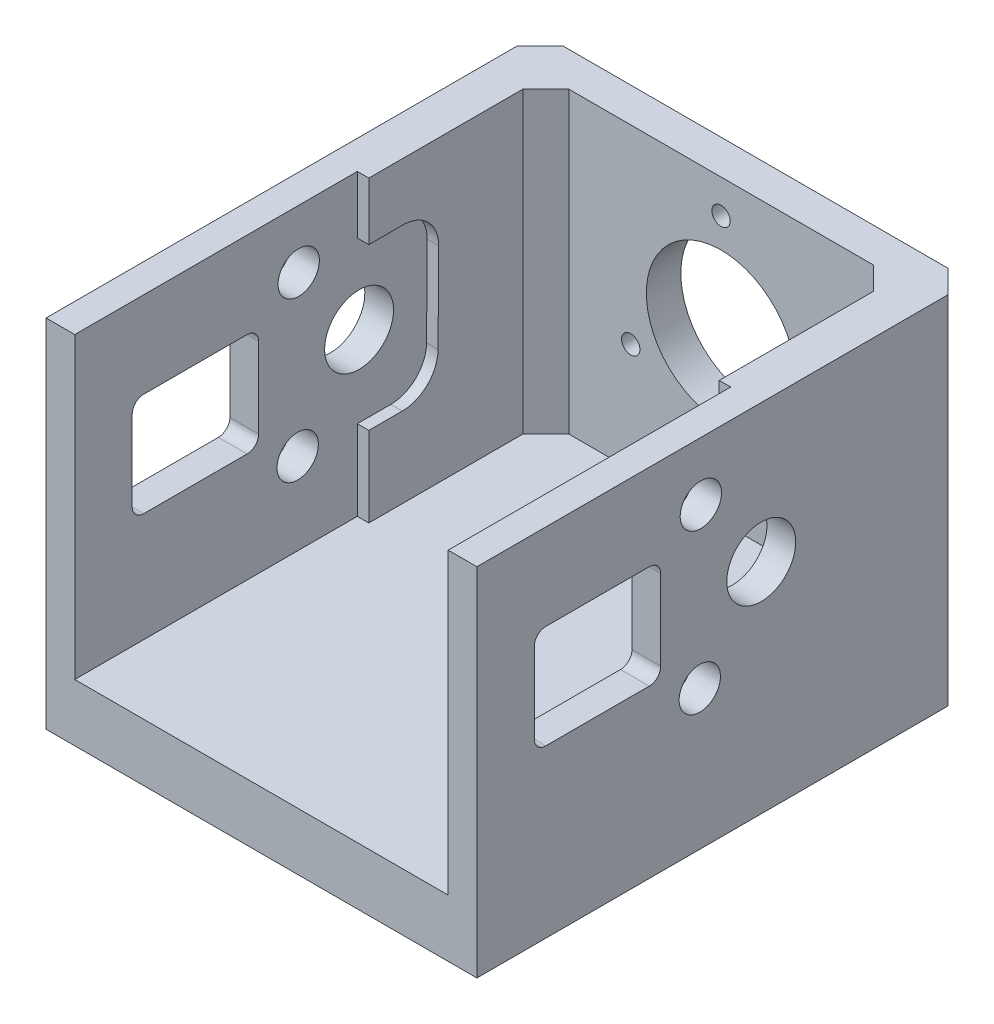
from build123d import *

# Parameters (mm, degrees)
SKETCH1_W            = 37.5
SKETCH1_H            = 24
SKETCH1_R            = 0.8
SKETCH1_R_2          = 6.5
BOSS_EXTRUDE1_DEPTH  = 3
SKETCH2_W            = 2.5
SKETCH2_H            = 40
BOSS_EXTRUDE2_DEPTH  = 24
BOSS_EXTRUDE3_DEPTH  = 1
BOSS_EXTRUDE4_START  = 31.5
BOSS_EXTRUDE4_DEPTH  = 1
M3_CLEARANCE_HOLE1_D = 3.6
CHAMFER1_SIZE        = 2
SKETCH7_R            = 3
SKETCH7_W            = 11
SKETCH7_H            = 9
CUT_EXTRUDE1_DEPTH   = 57.127087934
FILLET1_R            = 1
BOSS_EXTRUDE5_DEPTH  = 2
BOSS_EXTRUDE6_DEPTH  = 5


with BuildPart() as part:
    # Sketch1 → Boss-Extrude1 (new body)
    with BuildSketch(Plane.XY):
        Rectangle(SKETCH1_W, SKETCH1_H)
        with Locations((0, 9.075)):
            Circle(SKETCH1_R, mode=Mode.SUBTRACT)
        with Locations((7.859180539, -4.5375)):
            Circle(SKETCH1_R, mode=Mode.SUBTRACT)
        with Locations((-7.859180539, -4.5375)):
            Circle(SKETCH1_R, mode=Mode.SUBTRACT)
        Circle(SKETCH1_R_2, mode=Mode.SUBTRACT)
    extrude(amount=-BOSS_EXTRUDE1_DEPTH)

    # Sketch2 → Boss-Extrude2 (add)
    with BuildSketch(Plane(origin=(0, 12, 0), x_dir=(1, 0, 0), z_dir=(0, 1, 0))):
        with Locations((-17.5, -20)):
            Rectangle(SKETCH2_W, SKETCH2_H)
        with Locations((17.5, -20)):
            Rectangle(SKETCH2_W, SKETCH2_H)
    extrude(amount=-BOSS_EXTRUDE2_DEPTH)

    # Sketch4 → Boss-Extrude3 (add)
    with BuildSketch(Plane(origin=(-16.25, 0, 0), x_dir=(0, 0, -1), z_dir=(1, 0, 0))):
        with BuildLine():
            Line((-9.328443352, 3.861127794), (-9.37974654, -3.938739946))
            ThreePointArc((-9.37974654, -3.938739946), (-10.302425145, -6.124404492), (-12.500032536, -7.018265261))
            Line((-12.500032536, -7.018265261), (-15.407950321, -7.018265261))
            Line((-15.407950321, -7.018265261), (-15.407950321, -12))
            Line((-15.407950321, -12), (0, -12))
            Line((0, -12), (0, 12))
            Line((0, 12), (-15.407950321, 12))
            Line((-15.407950321, 12), (-15.407950321, 6.981431896))
            Line((-15.407950321, 6.981431896), (-12.407950321, 6.981431896))
            ThreePointArc((-12.407950321, 6.981431896), (-10.222291202, 6.058740436), (-9.328443352, 3.861127794))
        make_face()
    extrude(amount=BOSS_EXTRUDE3_DEPTH)

    # Sketch4<2> → Boss-Extrude4 (add)
    with BuildSketch(Plane(origin=(-16.25, 0, 0), x_dir=(0, 0, -1), z_dir=(1, 0, 0)).offset(BOSS_EXTRUDE4_START)):
        with BuildLine():
            Line((-9.328443352, 3.861127794), (-9.37974654, -3.938739946))
            ThreePointArc((-9.37974654, -3.938739946), (-10.302425145, -6.124404492), (-12.500032536, -7.018265261))
            Line((-12.500032536, -7.018265261), (-15.407950321, -7.018265261))
            Line((-15.407950321, -7.018265261), (-15.407950321, -12))
            Line((-15.407950321, -12), (0, -12))
            Line((0, -12), (0, 12))
            Line((0, 12), (-15.407950321, 12))
            Line((-15.407950321, 12), (-15.407950321, 6.981431896))
            Line((-15.407950321, 6.981431896), (-12.407950321, 6.981431896))
            ThreePointArc((-12.407950321, 6.981431896), (-10.222291202, 6.058740436), (-9.328443352, 3.861127794))
        make_face()
    extrude(amount=BOSS_EXTRUDE4_DEPTH)

    # M3 Clearance Hole1 (through all)
    with Locations(Plane(origin=(-18.75, 0, 0), x_dir=(0, 0, -1), z_dir=(-1, 0, 0))):
        with Locations((-20.599236057, 6.864991053), (-20.508469302, -6.934710444)):
            Hole(M3_CLEARANCE_HOLE1_D / 2)

    # Chamfer1
    chamfer1_edges = [part.edges().sort_by_distance(p)[0] for p in [
        (18.75, 0, -3),
        (-18.75, 0, -3),
        (-15.25, 0, 0),
        (15.25, 0, 0),
    ]]
    chamfer(chamfer1_edges, length=CHAMFER1_SIZE)

    # Sketch7 → Cut-Extrude1 (cut, through all)
    with BuildSketch(Plane.ZY.offset(18.75)):
        with Locations(Location((15.253967317, 7.63e-07, 0), (0, 0, 270))):
            Circle(SKETCH7_R)
        with Locations((29.5, 0)):
            Rectangle(SKETCH7_W, SKETCH7_H)
    extrude(amount=-CUT_EXTRUDE1_DEPTH, mode=Mode.SUBTRACT)

    # Fillet1
    fillet1_edges = [part.edges().sort_by_distance(p)[0] for p in [
        (-17.5, -4.5, 24),
        (-17.5, 4.5, 24),
        (-17.5, 4.5, 35),
        (-17.5, -4.5, 35),
        (17.5, -4.5, 24),
        (17.5, 4.5, 24),
        (17.5, 4.5, 35),
        (17.5, -4.5, 35),
    ]]
    fillet(fillet1_edges, radius=FILLET1_R)

    # Sketch8 → Boss-Extrude5 (add)
    with BuildSketch(Plane.XZ.offset(12)):
        Polygon((-16.75, -3), (16.75, -3), (18.75, -1), (18.75, 40), (16.25, 40), (16.25, 15.407950321), (15.25, 15.407950321), (15.25, 2), (13.25, 0), (-13.25, 0), (-15.25, 2), (-15.25, 15.407950321), (-16.25, 15.407950321), (-16.25, 40), (-18.75, 40), (-18.75, -1), align=None)
    extrude(amount=BOSS_EXTRUDE5_DEPTH)

    # Sketch9 → Boss-Extrude6 (add)
    with BuildSketch(Plane.XZ.offset(14)):
        Polygon((-18.75, 40), (18.75, 40), (18.75, -1), (16.75, -3), (-16.75, -3), (-18.75, -1), align=None)
    extrude(amount=BOSS_EXTRUDE6_DEPTH)


solid = part.part
